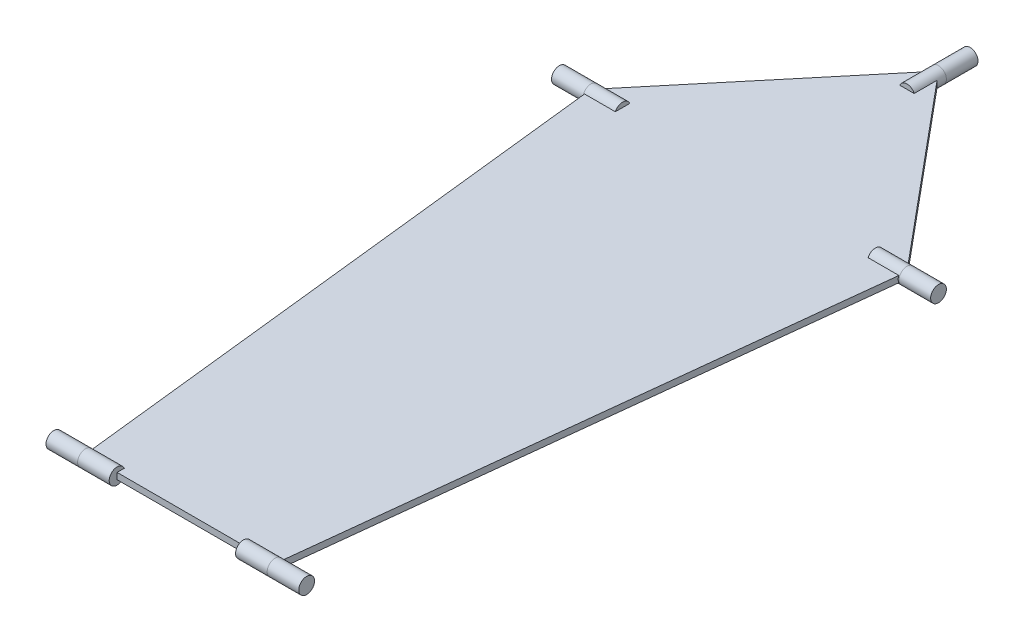
from build123d import *

# Parameters (mm, degrees)
BOSS_EXTRUDE1_DEPTH = 1.27
SWEEP1_PROFILE_R    = 3.175
SWEEP2_PROFILE_R    = 3.175
SWEEP3_PROFILE_R    = 3.175


with BuildPart() as part:
    # Sketch1 → Boss-Extrude1 (new, symmetric)
    with BuildSketch(Plane(origin=(0, 0, 0), x_dir=(1, 0, 0), z_dir=(0, 1, 0))):
        Polygon((0, 152.4), (0, -152.4), (-38.1, -152.4), (-63.5, 76.2), align=None)
    boss_extrude1 = extrude(amount=BOSS_EXTRUDE1_DEPTH, both=True)

    # Mirror1: Boss-Extrude1 across plane
    add(boss_extrude1.mirror(Plane(origin=(0, 0, 0), x_dir=(0, 0, 1), z_dir=(1, 0, 0))))

    # Sweep1: sweep along a path in Sketch2
    with BuildLine(Plane(origin=(0, 0, 0), x_dir=(1, 0, 0), z_dir=(0, 1, 0))) as sweep1_path:
        Line((-50.8, 76.2), (-63.5, 76.2))
        Line((-63.5, 76.2), (-76.2, 76.2))
    # Sweep1 profile (on start of the path) → Sweep1 (sweep)
    with BuildSketch(Plane(origin=(-50.8, 0, -76.2), x_dir=(0, 0, -1), z_dir=(-1, 0, 0))):
        Circle(SWEEP1_PROFILE_R)
    sweep1 = sweep(path=sweep1_path.line)

    # Sweep2: sweep along a path in Sketch10
    with BuildLine(Plane(origin=(0, 0, 0), x_dir=(1, 0, 0), z_dir=(0, 1, 0))) as sweep2_path:
        Line((-50.8, -152.4), (-38.1, -152.4))
        Line((-38.1, -152.4), (-25.4, -152.4))
    # Sweep2 profile (on start of the path) → Sweep2 (sweep)
    with BuildSketch(Plane(origin=(-50.8, 0, 152.4), x_dir=(0, 0, 1), z_dir=(1, 0, 0))):
        Circle(SWEEP2_PROFILE_R)
    sweep2 = sweep(path=sweep2_path.line)

    # Mirror3: Sweep1, Sweep2 across plane
    add(sweep1.mirror(Plane(origin=(0, 0, 0), x_dir=(0, 0, 1), z_dir=(1, 0, 0))))
    add(sweep2.mirror(Plane(origin=(0, 0, 0), x_dir=(0, 0, 1), z_dir=(1, 0, 0))))

    # Sweep3: sweep along a path in Sketch36
    with BuildLine(Plane(origin=(0, 0, 0), x_dir=(1, 0, 0), z_dir=(0, 1, 0))) as sweep3_path:
        Line((0, 165.1), (0, 152.4))
        Line((0, 152.4), (0, 139.7))
    # Sweep3 profile (on start of the path) → Sweep3 (sweep)
    with BuildSketch(Plane.XY.offset(-165.1)):
        Circle(SWEEP3_PROFILE_R)
    sweep(path=sweep3_path.line)


solid = part.part
